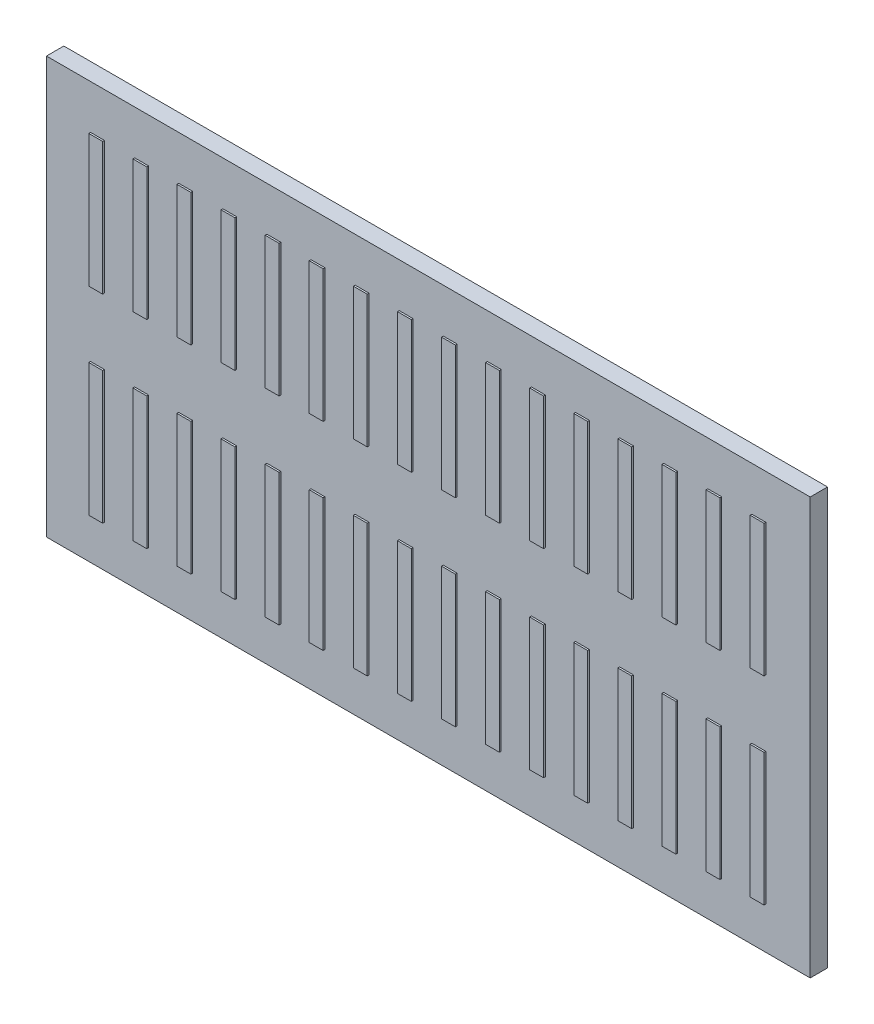
from build123d import *

# Parameters (mm, degrees)
SKETCH1_W            = 110
SKETCH1_H            = 60
BOSS_EXTRUDE1_DEPTH  = 2.5
SKETCH3_W            = 2
SKETCH3_H            = 19.05
BOSS_EXTRUDE2_DEPTH  = 0.254
LPATTERN1_COUNT      = 16
LPATTERN1_PITCH      = 6.35
LPATTERN1_COUNT_DIR2 = 2
LPATTERN1_PITCH_DIR2 = 28.575


with BuildPart() as part:
    # Sketch1 → Boss-Extrude1 (new body)
    with BuildSketch(Plane.XY):
        with Locations((55, 30)):
            Rectangle(SKETCH1_W, SKETCH1_H)
    extrude(amount=BOSS_EXTRUDE1_DEPTH)

    # Sketch3 → Boss-Extrude2 (add)
    with BuildSketch(Plane.XY.offset(2.5)):
        with Locations((7.35, 44.125)):
            Rectangle(SKETCH3_W, SKETCH3_H)
    boss_extrude2 = extrude(amount=BOSS_EXTRUDE2_DEPTH)

    # LPattern1: Boss-Extrude2 16 × 2
    with Locations(*[(i * LPATTERN1_PITCH, -j * LPATTERN1_PITCH_DIR2, 0) for i in range(LPATTERN1_COUNT) for j in range(LPATTERN1_COUNT_DIR2) if (i, j) != (0, 0)]):
        add(boss_extrude2)


solid = part.part
